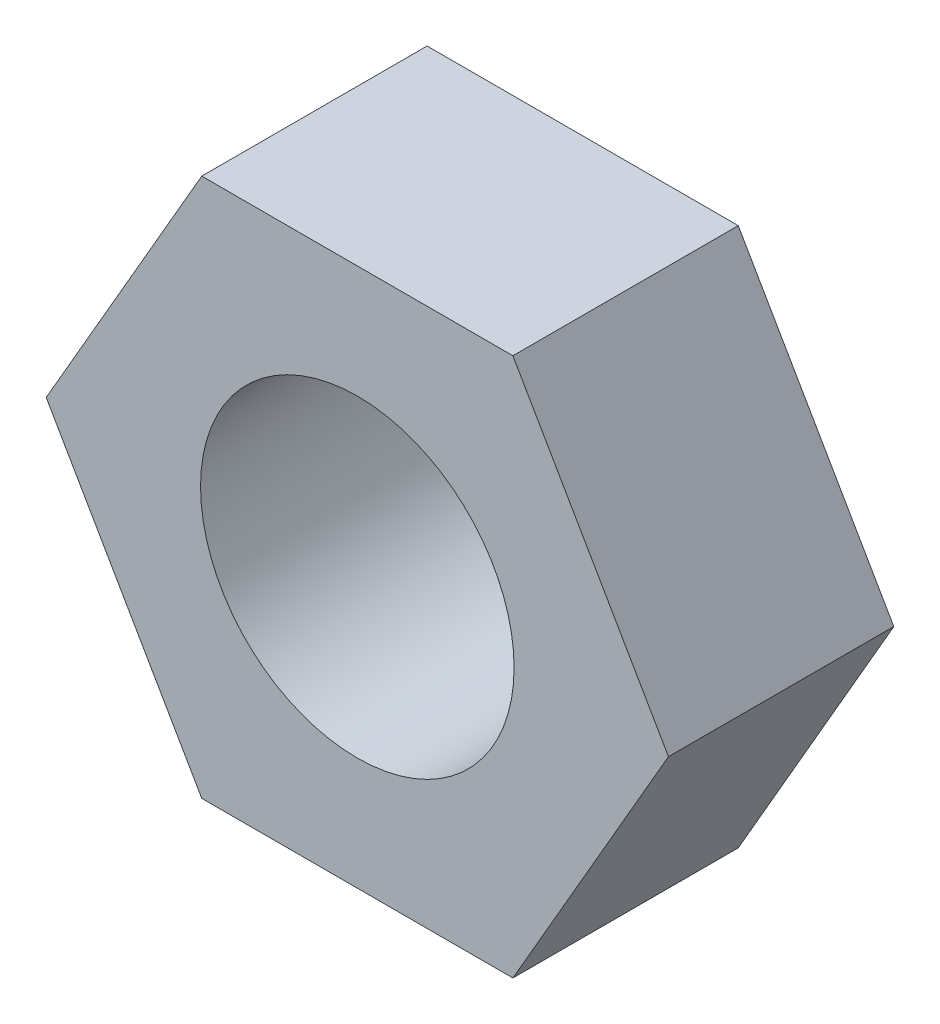
from build123d import *

# Parameters (mm, degrees)
ESBO_O1_R                = 1.6
RESSALTO_EXTRUS_O1_DEPTH = 2.3


with BuildPart() as part:
    # Esboço1 → Ressalto-extrusão1 (new body)
    with BuildSketch(Plane.XY):
        Polygon((1.58771324, 2.75), (-1.58771324, 2.75), (-3.175426481, 0), (-1.58771324, -2.75), (1.58771324, -2.75), (3.175426481, 0), align=None)
        Circle(ESBO_O1_R, mode=Mode.SUBTRACT)
    extrude(amount=RESSALTO_EXTRUS_O1_DEPTH)


solid = part.part
